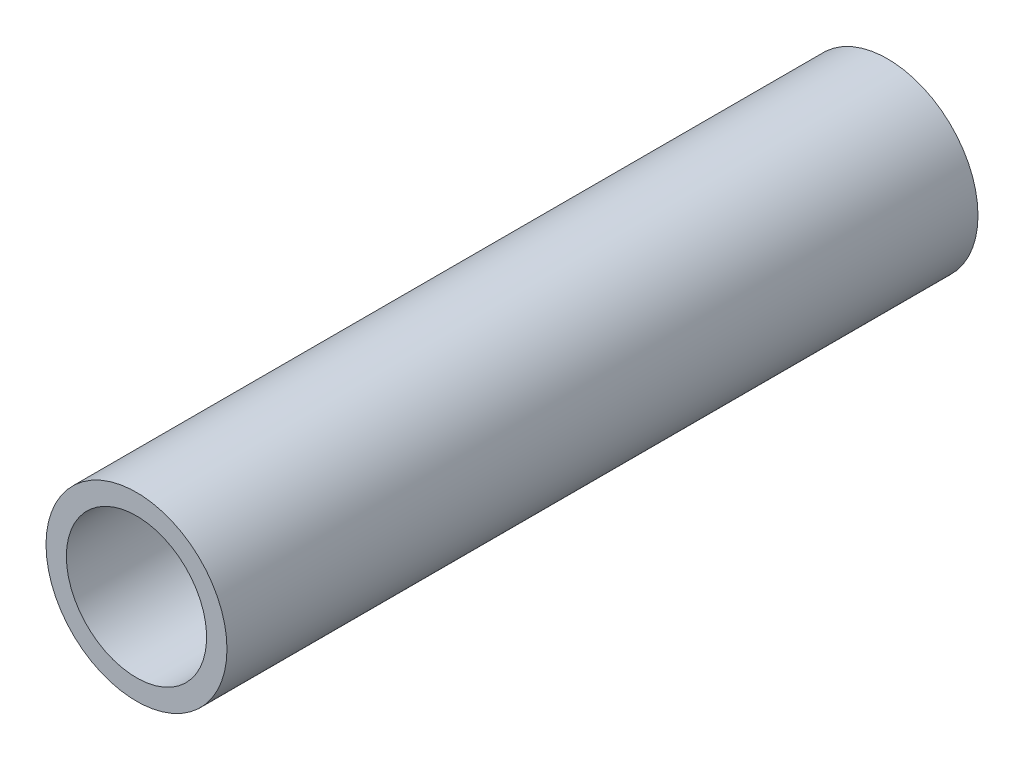
from build123d import *

# Parameters (mm, degrees)
SKETCH_1_R      = 1
SKETCH_1_R_2    = 0.775
EXTRUDE_1_DEPTH = 8.3


with BuildPart() as part:
    # Эскиз1 → Бобышка-Вытянуть1 (new body)
    with BuildSketch(Plane.XY):
        with Locations(Location((0, 0, 0), (0, 0, 180))):
            Circle(SKETCH_1_R)
        with Locations(Location((0, 0, 0), (0, 0, 180))):
            Circle(SKETCH_1_R_2, mode=Mode.SUBTRACT)
    extrude(amount=EXTRUDE_1_DEPTH)


solid = part.part
